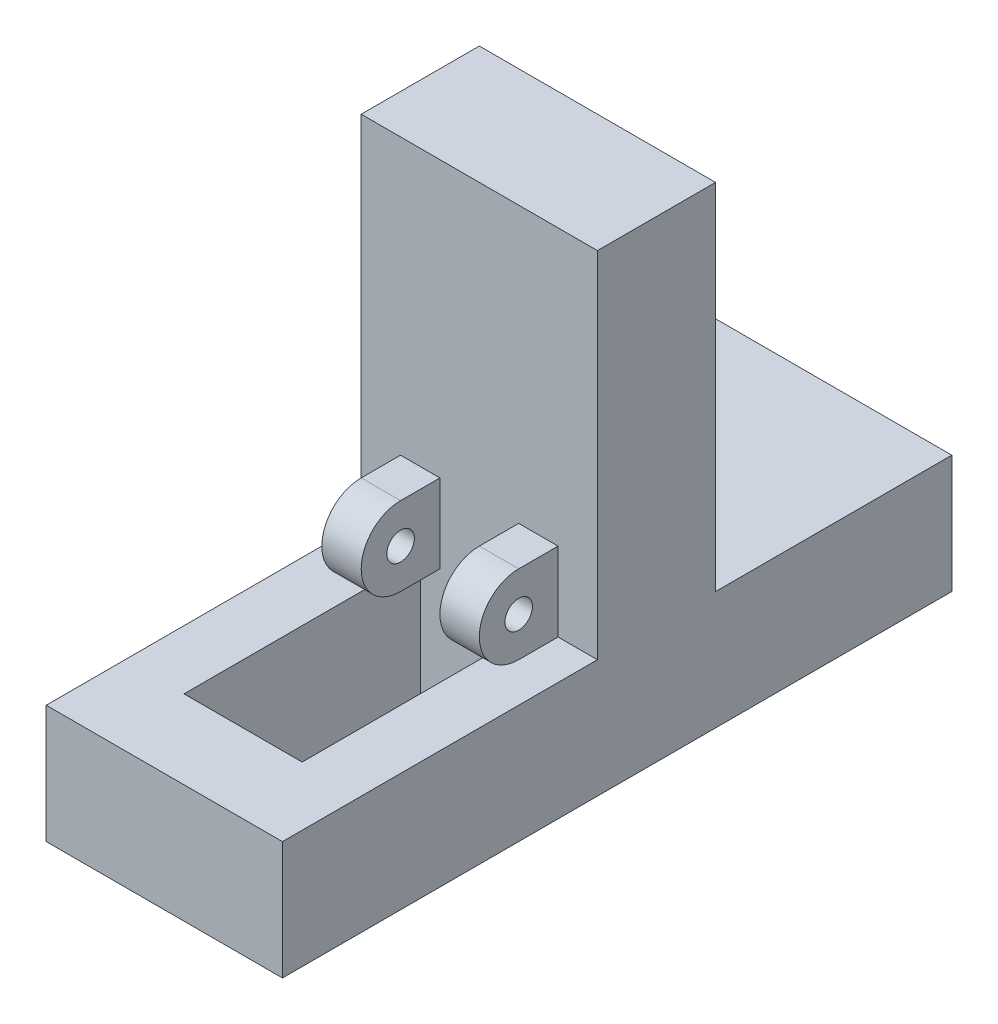
from build123d import *
from build123d.topology import SkipClean

# Parameters (mm, degrees)
SKETCH1_W           = 30
SKETCH1_H           = 60
SKETCH1_R           = 1.75
BOSS_EXTRUDE1_DEPTH = 15
SKETCH4_R           = 1.75
BOSS_EXTRUDE3_DEPTH = 30
SKETCH5_W           = 5
SKETCH5_H           = 10
SKETCH5_W_2         = 10
CUT_EXTRUDE1_DEPTH  = 69.738635424
SKETCH6_W           = 7.5
SKETCH6_H           = 15
BOSS_EXTRUDE4_DEPTH = 30
SKETCH7_W           = 30
SKETCH7_H           = 15
BOSS_EXTRUDE5_DEPTH = 10
BOSS_EXTRUDE6_START = 30
SKETCH8_W           = 30
SKETCH8_H           = 15
SKETCH8_R           = 1.75
BOSS_EXTRUDE6_DEPTH = 30


with BuildPart() as part:
    # Sketch1 → Boss-Extrude1 (new body)
    with BuildSketch(Plane.XY):
        with Locations((15, 30)):
            Rectangle(SKETCH1_W, SKETCH1_H)
        with Locations((15, 10)):
            Circle(SKETCH1_R, mode=Mode.SUBTRACT)
    extrude(amount=BOSS_EXTRUDE1_DEPTH)

    # Sketch4 → Boss-Extrude3 (add)
    with BuildSketch(Plane(origin=(30, 0, 0), x_dir=(0, 0, -1), z_dir=(1, 0, 0))):
        with BuildLine():
            Line((-15, 15), (-20, 15))
            ThreePointArc((-20, 15), (-25, 20), (-20, 25))
            Line((-20, 25), (-15, 25))
            Line((-15, 25), (-15, 15))
        make_face()
        with Locations((-20, 20)):
            Circle(SKETCH4_R, mode=Mode.SUBTRACT)
    extrude(amount=-BOSS_EXTRUDE3_DEPTH)

    # Sketch5 → Cut-Extrude1 (cut, through all)
    with BuildSketch(Plane.XY.offset(15)):
        with Locations((2.5, 20)):
            Rectangle(SKETCH5_W, SKETCH5_H)
        with Locations((15, 20)):
            Rectangle(SKETCH5_W_2, SKETCH5_H)
        with Locations((27.5, 20)):
            Rectangle(SKETCH5_W, SKETCH5_H)
    extrude(amount=CUT_EXTRUDE1_DEPTH, mode=Mode.SUBTRACT)

    # Sketch6 → Boss-Extrude4 (add)
    with BuildSketch(Plane.XY.offset(15)):
        with Locations((3.75, 7.5)):
            Rectangle(SKETCH6_W, SKETCH6_H)
        with Locations((26.25, 7.5)):
            Rectangle(SKETCH6_W, SKETCH6_H)
    extrude(amount=BOSS_EXTRUDE4_DEPTH)

    # Sketch7 → Boss-Extrude5 (add)
    with BuildSketch(Plane.XY.offset(45)):
        with Locations((15, 7.5)):
            Rectangle(SKETCH7_W, SKETCH7_H)
    extrude(amount=BOSS_EXTRUDE5_DEPTH)

    # Sketch8 → Boss-Extrude6 (add)
    with SkipClean():  # the faces are left unmerged after this step: merging them gives an invalid solid
        with BuildSketch(Plane(origin=(0, 0, 0), x_dir=(-1, 0, 0), z_dir=(0, 0, -1)).offset(BOSS_EXTRUDE6_START)):
            with Locations((-15, 7.5)):
                Rectangle(SKETCH8_W, SKETCH8_H)
            with Locations((-15, 10)):
                Circle(SKETCH8_R, mode=Mode.SUBTRACT)
        extrude(amount=-BOSS_EXTRUDE6_DEPTH)


solid = part.part
